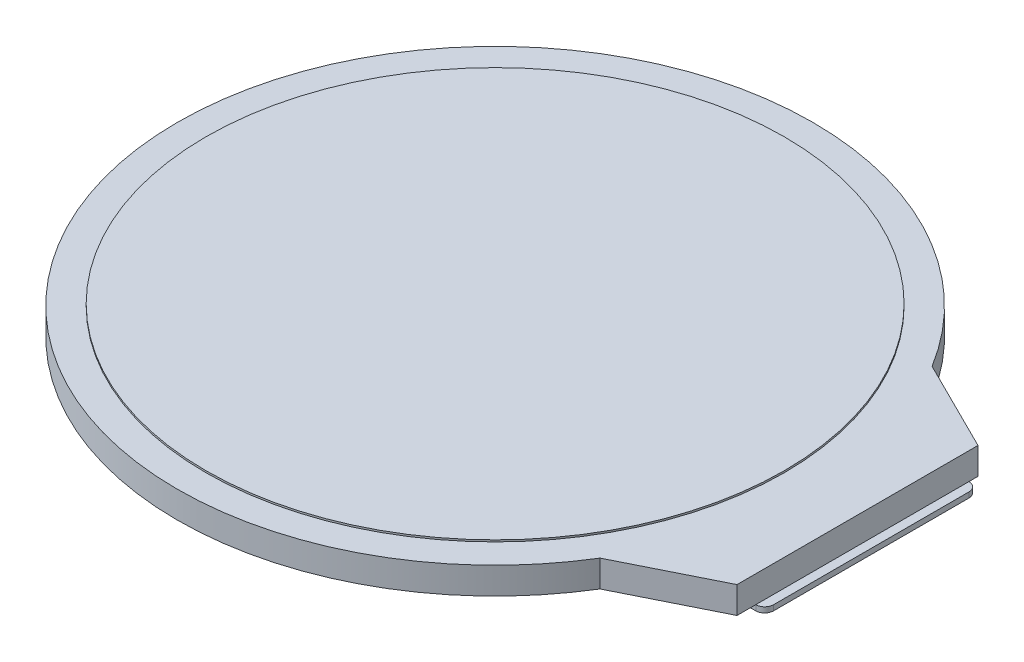
from build123d import *

# Parameters (mm, degrees)
EXTRUDE_1_DEPTH = 1.5
SKETCH_3_R      = 16.2
EXTRUDE_2_DEPTH = 0.1
EXTRUDE_3_DEPTH = 0.3
FILLET_1_R      = 0.5


with BuildPart() as part:
    # 草图1 → 凸台-拉伸1 (new body)
    with BuildSketch(Plane(origin=(0, 0, 0), x_dir=(1, 0, 0), z_dir=(0, 1, 0))):
        with BuildLine():
            Line((20.3, 6.75), (20.3, -6.75))
            Line((20.3, -6.75), (15.17728566, -9.3))
            ThreePointArc((15.17728566, -9.3), (-17.8, 0), (15.17728566, 9.3))
            Line((15.17728566, 9.3), (20.3, 6.75))
        make_face()
    extrude(amount=EXTRUDE_1_DEPTH)

    # 草图3 → 凸台-拉伸2 (add)
    with BuildSketch(Plane(origin=(0, 1.5, 0), x_dir=(1, 0, 0), z_dir=(0, 1, 0))):
        with Locations(Location((0, 0, 0), (0, 0, 270))):
            Circle(SKETCH_3_R)
    extrude(amount=EXTRUDE_2_DEPTH)

    # 草图4 → 凸台-拉伸3 (add)
    with BuildSketch(Plane.XZ):
        Polygon((20.8, -6.24), (20.8, 5.7), (10.06, 5.7), (10.06, -5.7), (13.26, -5.7), (13.8, -6.24), align=None)
        with BuildLine():
            add(Edge.make_bspline(
                [(10.818486802, -4.395328042), (10.805172896, -4.40810149), (10.777735498, -4.434425106), (10.731585338, -4.471001471), (10.680718947, -4.50727864), (10.644265505, -4.529889796), (10.625504346, -4.541526873)],
                knots=[0, 0, 0, 0, 0.911926792, 1.879305458, 2.908561558, 4, 4, 4, 4], degree=3))
            Line((10.625504346, -4.541526873), (10.625504346, -4.430415762))
            add(Edge.make_bspline(
                [(10.625504346, -4.430415762), (10.637511845, -4.422097374), (10.661358973, -4.405576894), (10.695199347, -4.378706463), (10.727916327, -4.35134661), (10.758520561, -4.322379824), (10.787985268, -4.292793589), (10.815334495, -4.261758783), (10.841379972, -4.22987118), (10.857300173, -4.207631606), (10.865270428, -4.196497633)],
                knots=[0, 0, 0, 0, 1.040526584, 2.066506081, 3.077559129, 4.07840537, 5.067830316, 6.05167646, 7.024595449, 8, 8, 8, 8], degree=3))
            Line((10.865270428, -4.196497633), (10.935445867, -4.196497633))
            Line((10.935445867, -4.196497633), (10.935445867, -5.202345586))
            Line((10.935445867, -5.202345586), (10.818486802, -5.202345586))
            Line((10.818486802, -5.202345586), (10.818486802, -4.395328042))
        make_face(mode=Mode.SUBTRACT)
        with BuildLine():
            add(Edge.make_bspline(
                [(10.747897656, 4.993028455), (10.734583749, 4.980255007), (10.707146352, 4.953931392), (10.660996192, 4.917355027), (10.610129801, 4.881077858), (10.573676359, 4.858466702), (10.5549152, 4.846829625)],
                knots=[0, 0, 0, 0, 0.911926792, 1.879305458, 2.908561558, 4, 4, 4, 4], degree=3))
            Line((10.5549152, 4.846829625), (10.5549152, 4.957940736))
            add(Edge.make_bspline(
                [(10.5549152, 4.957940736), (10.566922699, 4.966259124), (10.590769826, 4.982779604), (10.6246102, 5.009650034), (10.65732718, 5.037009887), (10.687931415, 5.065976673), (10.717396122, 5.095562908), (10.744745348, 5.126597715), (10.770790825, 5.158485318), (10.786711026, 5.180724892), (10.794681281, 5.191858864)],
                knots=[0, 0, 0, 0, 1.040526584, 2.066506081, 3.077559129, 4.07840537, 5.067830316, 6.05167646, 7.024595449, 8, 8, 8, 8], degree=3))
            Line((10.794681281, 5.191858864), (10.86485672, 5.191858864))
            Line((10.86485672, 5.191858864), (10.86485672, 4.186010911))
            Line((10.86485672, 4.186010911), (10.747897656, 4.186010911))
            Line((10.747897656, 4.186010911), (10.747897656, 4.993028455))
        make_face(mode=Mode.SUBTRACT)
        with BuildLine():
            add(Edge.make_bspline(
                [(11.239125726, 4.209402724), (11.239833141, 4.216646412), (11.241239164, 4.23104361), (11.246176296, 4.252223765), (11.253123203, 4.272903106), (11.262262649, 4.29307236), (11.273547522, 4.312739702), (11.287428195, 4.331488732), (11.302928415, 4.350145808), (11.321465332, 4.367779976), (11.341452247, 4.386542756), (11.362154394, 4.408019092), (11.384577692, 4.431466047), (11.407813575, 4.457882847), (11.432843118, 4.486319526), (11.458703548, 4.517616287), (11.486012518, 4.551174546), (11.514003658, 4.586370362), (11.541434011, 4.621720239), (11.56671184, 4.65597954), (11.589699984, 4.687968259), (11.610212924, 4.717799327), (11.627704069, 4.745816407), (11.642893445, 4.771584725), (11.655854012, 4.795057685), (11.668787399, 4.823092213), (11.680993939, 4.855423395), (11.690565178, 4.892152564), (11.694914493, 4.926144912), (11.693204675, 4.957381602), (11.686490374, 4.98588729), (11.674759334, 5.011748614), (11.658296591, 5.035057433), (11.637248958, 5.054942362), (11.613257207, 5.071313574), (11.586558607, 5.082313299), (11.557991357, 5.087872292), (11.528104736, 5.087369351), (11.497980127, 5.082013566), (11.467969579, 5.072704256), (11.439039112, 5.058289936), (11.410696566, 5.040307531), (11.384436934, 5.017140759), (11.36135616, 4.988611831), (11.341721738, 4.954866078), (11.331926076, 4.929936265), (11.326845024, 4.917005063)],
                knots=[0, 0, 0, 0, 0.683264685, 1.358023177, 2.0380809, 2.730345762, 3.435487858, 4.164189287, 4.919895072, 5.711413948, 6.565494804, 7.49616148, 8.513531843, 9.613812574, 10.80147361, 12.073102873, 13.428218159, 14.866997124, 16.298560904, 17.632315587, 18.867297526, 20.000038836, 21.033387935, 21.969994494, 22.810824564, 23.551397478, 24.869445784, 26.052467085, 27.111050094, 28.075902372, 28.975949733, 29.847314516, 30.728213316, 31.639844513, 32.554273251, 33.442456201, 34.333871785, 35.270085163, 36.233696473, 37.201335111, 38.211692251, 39.261697588, 40.347896805, 41.485826765, 42.695887429, 44, 44, 44, 44], degree=3))
            Line((11.326845024, 4.917005063), (11.215733913, 4.934548923))
            add(Edge.make_bspline(
                [(11.215733913, 4.934548923), (11.219656813, 4.945425545), (11.227289073, 4.966586728), (11.240431556, 4.996719226), (11.254008051, 5.024768665), (11.268391205, 5.050549193), (11.283893055, 5.073876788), (11.300137608, 5.094978241), (11.317197246, 5.113850725), (11.335137556, 5.130472165), (11.35389693, 5.145124772), (11.373604192, 5.157831984), (11.394013956, 5.168932074), (11.415206508, 5.178352557), (11.43722761, 5.185944542), (11.460175176, 5.191465532), (11.483814494, 5.195748716), (11.499956502, 5.19704853), (11.508131574, 5.197706818)],
                knots=[0, 0, 0, 0, 1.318688324, 2.565594597, 3.747971738, 4.872722892, 5.930337296, 6.940181326, 7.908044283, 8.828858542, 9.726735078, 10.619953387, 11.500744836, 12.374616489, 13.262770363, 14.15366946, 15.064931369, 16, 16, 16, 16], degree=3))
            add(Edge.make_bspline(
                [(11.508131574, 5.197706818), (11.517654805, 5.198470616), (11.536175647, 5.199956055), (11.563321528, 5.200235741), (11.588939793, 5.198463956), (11.613483722, 5.195099015), (11.637461864, 5.189150579), (11.661491911, 5.180373219), (11.685801114, 5.168509643), (11.710349938, 5.153958828), (11.73441354, 5.136146543), (11.756199385, 5.11374856), (11.775424492, 5.087198528), (11.792601639, 5.05716399), (11.806466377, 5.023396102), (11.814804628, 4.985783772), (11.817862258, 4.944983333), (11.816182176, 4.908994618), (11.812089602, 4.878541375), (11.806355457, 4.854202585), (11.798091587, 4.828865854), (11.788361792, 4.802138754), (11.775441683, 4.774655097), (11.760899169, 4.745824926), (11.74350862, 4.716170927), (11.727726825, 4.690551343), (11.713428345, 4.669220128), (11.70145212, 4.651813704), (11.688368763, 4.633233154), (11.673683781, 4.613773904), (11.658174582, 4.592989779), (11.641491734, 4.571060318), (11.623490026, 4.548175641), (11.604377689, 4.524045702), (11.584068424, 4.498734851), (11.562470569, 4.472389765), (11.539590091, 4.445069691), (11.51578304, 4.416404416), (11.490759524, 4.386634205), (11.46450038, 4.355787108), (11.436918885, 4.324002126), (11.418239887, 4.302325786), (11.408716369, 4.291274069)],
                knots=[0, 0, 0, 0, 0.924262298, 1.797511285, 2.623724224, 3.407158757, 4.191620419, 5.009283641, 5.877881841, 6.805175164, 7.767818098, 8.765683208, 9.814991193, 10.931884262, 12.107176208, 13.332417047, 14.642951659, 16.055476784, 16.810263112, 17.613474593, 18.470705512, 19.388078144, 20.363412498, 21.406914204, 22.511682051, 23.688322701, 24.318011351, 24.996206783, 25.732766533, 26.516574724, 27.354866926, 28.242087009, 29.182574856, 30.172115786, 31.220563025, 32.322544456, 33.468316952, 34.668650042, 35.928027342, 37.231299145, 38.588373428, 40, 40, 40, 40], degree=3))
            Line((11.408716369, 4.291274069), (11.829769001, 4.291274069))
            Line((11.829769001, 4.291274069), (11.829769001, 4.186010911))
            Line((11.829769001, 4.186010911), (11.239125726, 4.186010911))
            Line((11.239125726, 4.186010911), (11.239125726, 4.209402724))
        make_face(mode=Mode.SUBTRACT)
    extrude(amount=EXTRUDE_3_DEPTH)

    # 圆角1
    fillet_1_edges = [part.edges().sort_by_distance(p)[0] for p in [
        (10.06, -0.15, -5.7),
        (10.06, -0.15, 5.7),
        (20.8, -0.15, 5.7),
        (20.8, -0.15, -6.24),
    ]]
    fillet(fillet_1_edges, radius=FILLET_1_R)


solid = part.part
